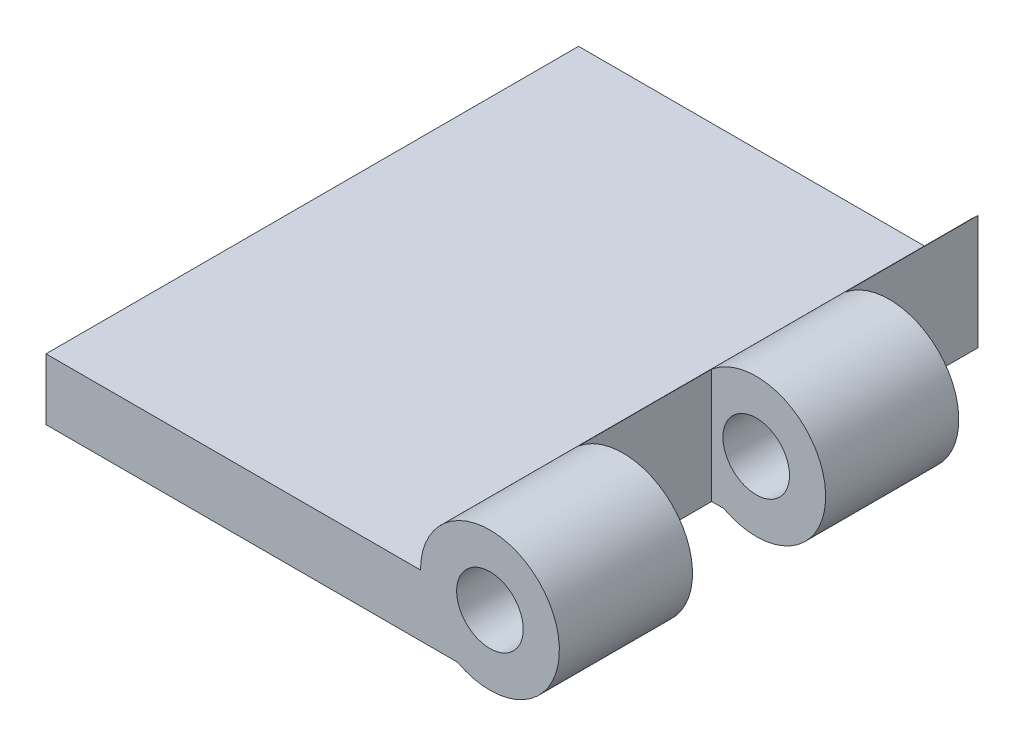
from build123d import *

# Parameters (mm, degrees)
SKETCH1_R               = 3.175
BOSS_EXTRUDE1_DEPTH     = 50.8
CUT_EXTRUDE1_DEPTH      = 64.844432524
CUT_EXTRUDE1_DEPTH_BACK = 64.844432524
SKETCH2_W               = 10.868428171
SKETCH2_H               = 12.7
SKETCH2_H_2             = 12.700000009


with BuildPart() as part:
    # Sketch1 → Boss-Extrude1 (new body)
    with BuildSketch(Plane.XY):
        with BuildLine():
            Line((1.143472567, 262.725830005), (-38.1, 262.725830005))
            Line((-38.1, 262.725830005), (-38.1, 268.577174682))
            Line((-38.1, 268.577174682), (-2.377184588, 268.577174682))
            ThreePointArc((-2.377184588, 268.577174682), (9.92041245, 271.991602208), (1.143472567, 262.725830005))
        make_face()
        with Locations((4.245621792, 268.577174682)):
            Circle(SKETCH1_R, mode=Mode.SUBTRACT)
    extrude(amount=-BOSS_EXTRUDE1_DEPTH)

    # Sketch2 → Cut-Extrude1 (cut, two sides: drawn at the far end of the back side and taken through both)
    with BuildSketch(Plane(origin=(0, 268.577174682, 0), x_dir=(1, 0, 0), z_dir=(0, 1, 0)).offset(-CUT_EXTRUDE1_DEPTH_BACK)):
        with Locations((5.434214086, 19.05)):
            Rectangle(SKETCH2_W, SKETCH2_H)
        with Locations((5.434214086, 44.449999996)):
            Rectangle(SKETCH2_W, SKETCH2_H_2)
    extrude(amount=CUT_EXTRUDE1_DEPTH + CUT_EXTRUDE1_DEPTH_BACK, mode=Mode.SUBTRACT)


solid = part.part
